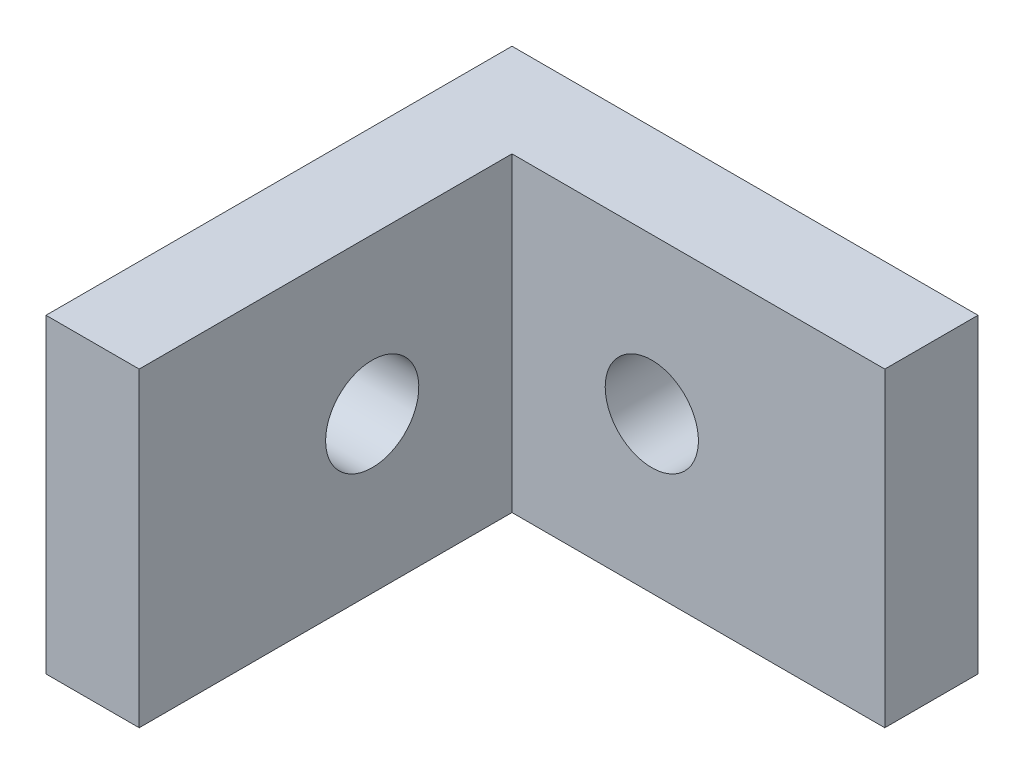
from build123d import *

# Parameters (mm, degrees)
SKETCH_1_W          = 15
SKETCH_1_H          = 10
EXTRUDE_1_DEPTH     = 3
SKETCH_2_W          = 3
SKETCH_2_H          = 10
EXTRUDE_2_DEPTH     = 12
SKETCH_3_R          = 1.5
CUT_EXTRUDE_1_DEPTH = 7
SKETCH_4_R          = 1.5
CUT_EXTRUDE_2_DEPTH = 7


with BuildPart() as part:
    # 草图1 → 凸台-拉伸1 (new body)
    with BuildSketch(Plane.XY):
        Rectangle(SKETCH_1_W, SKETCH_1_H)
    extrude(amount=EXTRUDE_1_DEPTH)

    # 草图2 → 凸台-拉伸2 (add)
    with BuildSketch(Plane.XY.offset(3)):
        with Locations((-6, 0)):
            Rectangle(SKETCH_2_W, SKETCH_2_H)
    extrude(amount=EXTRUDE_2_DEPTH)

    # 草图3 → 切除-拉伸1 (cut)
    with BuildSketch(Plane(origin=(0, 0, 0), x_dir=(-1, 0, 0), z_dir=(0, 0, -1))):
        Circle(SKETCH_3_R)
    extrude(amount=-CUT_EXTRUDE_1_DEPTH, mode=Mode.SUBTRACT)

    # 草图4 → 切除-拉伸2 (cut)
    with BuildSketch(Plane.ZY.offset(7.5)):
        with Locations((7.5, 0)):
            Circle(SKETCH_4_R)
    extrude(amount=-CUT_EXTRUDE_2_DEPTH, mode=Mode.SUBTRACT)


solid = part.part
